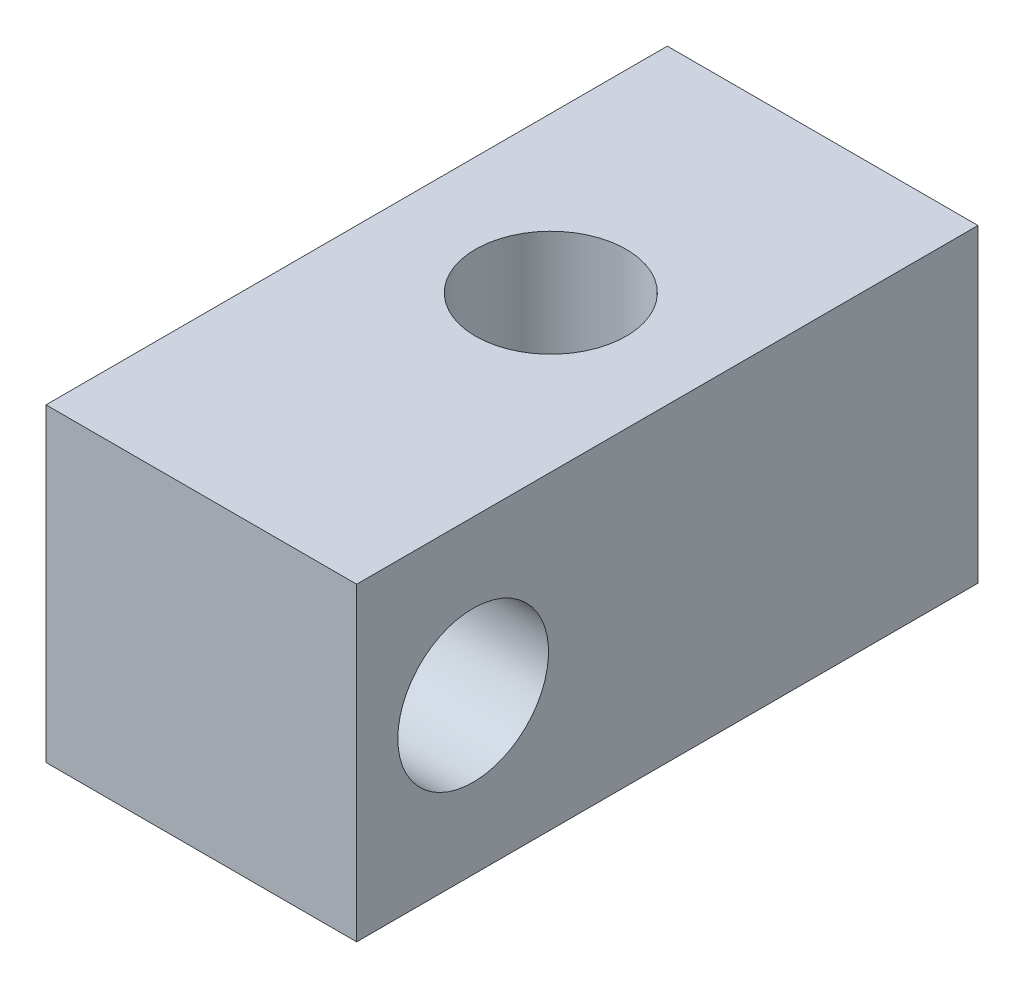
from build123d import *

# Parameters (mm, degrees)
SKETCH1_W                       = 10
SKETCH1_H                       = 9.970930233
BOSS_EXTRUDE1_DEPTH             = 20
F_11_0_191_DIAMETER_HOLE6_D     = 4.8514
F_11_0_191_DIAMETER_HOLE6_DEPTH = 4
F_11_0_191_DIAMETER_HOLE6_TIP   = 1.457507604
F_11_0_191_DIAMETER_HOLE7_D     = 4.8514
F_11_0_191_DIAMETER_HOLE8_D     = 4.8514


with BuildPart() as part:
    # Sketch1 → Boss-Extrude1 (new body)
    with BuildSketch(Plane.XY):
        with Locations((-5, 4.985465117)):
            Rectangle(SKETCH1_W, SKETCH1_H)
    extrude(amount=BOSS_EXTRUDE1_DEPTH)

    # #11 (0.191) Diameter Hole6
    with Locations(Plane(origin=(0, 0, 0), x_dir=(-1, 0, 0), z_dir=(0, 0, -1))):
        with Locations((5, 4.985465116)):
            Hole(F_11_0_191_DIAMETER_HOLE6_D / 2, depth=F_11_0_191_DIAMETER_HOLE6_DEPTH)
            with Locations((0, 0, -(F_11_0_191_DIAMETER_HOLE6_DEPTH + F_11_0_191_DIAMETER_HOLE6_TIP / 2))):  # 118° drill point
                Cone(0, F_11_0_191_DIAMETER_HOLE6_D / 2, F_11_0_191_DIAMETER_HOLE6_TIP, mode=Mode.SUBTRACT)

    # #11 (0.191) Diameter Hole7 (through all)
    with Locations(Plane(origin=(0, 9.970930233, 0), x_dir=(1, 0, 0), z_dir=(0, 1, 0))):
        with Locations((-5, -8.75)):
            Hole(F_11_0_191_DIAMETER_HOLE7_D / 2)

    # #11 (0.191) Diameter Hole8 (through all)
    with Locations(Plane.ZY.offset(10)):
        with Locations((16.25, 5)):
            Hole(F_11_0_191_DIAMETER_HOLE8_D / 2)


solid = part.part
